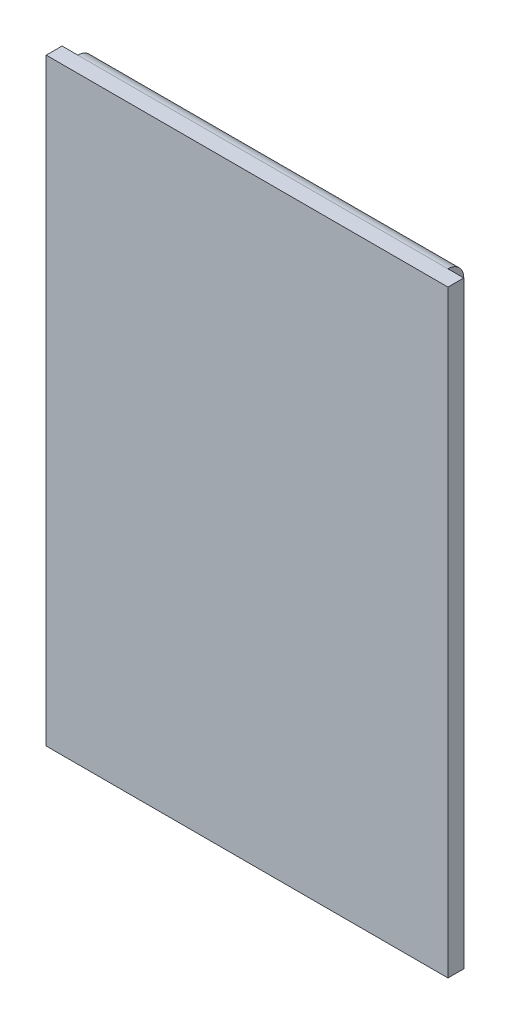
from build123d import *

# Parameters (mm, degrees)
BOSS_EXTRUDE2_DEPTH = 75.66
SKETCH2_W           = 2
SKETCH2_H           = 2
CUT_EXTRUDE2_DEPTH  = 69
FILLET1_R           = 2
BOSS_EXTRUDE5_DEPTH = 1


with BuildPart() as part:
    # Sketch1 → Boss-Extrude2 (new body)
    with BuildSketch(Plane(origin=(0, 0, 0), x_dir=(1, 0, 0), z_dir=(0, 1, 0))):
        Polygon((-19.20717284, 15.283675177), (27.59282716, 15.283675177), (27.59282716, 13.283675177), (29.59282716, 13.283675177), (29.59282716, 11.283675177), (-21.20717284, 11.283675177), (-21.20717284, 13.283675177), (-19.20717284, 13.283675177), align=None)
    extrude(amount=BOSS_EXTRUDE2_DEPTH)

    # Sketch2 → Cut-Extrude2 (cut)
    with BuildSketch(Plane(origin=(27.59282716, 0, 0), x_dir=(0, 0, -1), z_dir=(1, 0, 0))):
        with Locations((14.283675177, 1)):
            Rectangle(SKETCH2_W, SKETCH2_H)
    extrude(amount=-CUT_EXTRUDE2_DEPTH, mode=Mode.SUBTRACT)

    # Fillet1
    fillet1_edges = [part.edges().sort_by_distance(p)[0] for p in [
        (4.19282716, 75.66, -15.283675177),
    ]]
    fillet(fillet1_edges, radius=FILLET1_R)

    # Sketch3 → Boss-Extrude5 (add)
    with BuildSketch(Plane(origin=(0, 0, -15.283675177), x_dir=(-1, 0, 0), z_dir=(0, 0, -1))):
        Polygon((2.614345679, 73.441300995), (-8.385654321, 73.441300995), (-9.385654321, 73.441300995), (-9.385654321, 71.441300995), (-8.385654321, 71.441300995), (2.614345679, 71.441300995), align=None)
    extrude(amount=BOSS_EXTRUDE5_DEPTH)


solid = part.part
